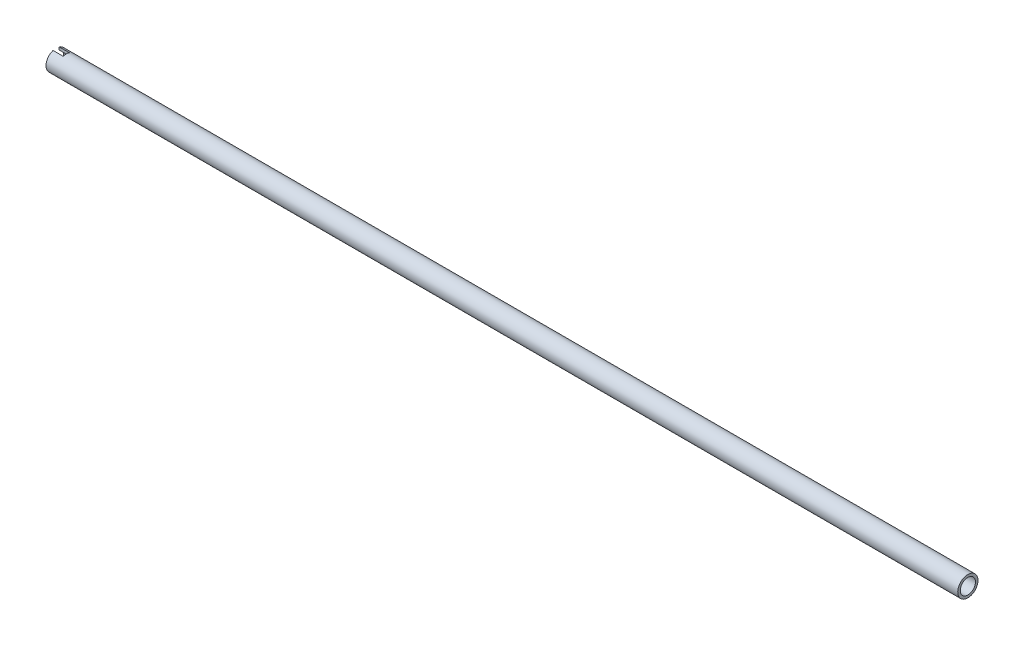
from build123d import *

# Parameters (mm, degrees)
SKETCH1_R           = 1
SKETCH1_R_2         = 0.75
BOSS_EXTRUDE1_DEPTH = 90
CUT_EXTRUDE1_DEPTH  = 1


with BuildPart() as part:
    # Sketch1 → Boss-Extrude1 (new body)
    with BuildSketch(Plane(origin=(0, 0, 0), x_dir=(0, 0, -1), z_dir=(1, 0, 0))):
        Circle(SKETCH1_R)
        Circle(SKETCH1_R_2, mode=Mode.SUBTRACT)
    extrude(amount=BOSS_EXTRUDE1_DEPTH)

    # Sketch2 → Cut-Extrude1 (cut)
    with BuildSketch(Plane.ZY):
        with BuildLine():
            Line((-0.304, 0.610565492), (-0.304, 1.099202537))
            Line((-0.304, 1.099202537), (0.304, 1.099202537))
            Line((0.304, 1.099202537), (0.304, 0.610565492))
            ThreePointArc((0.304, 0.610565492), (0, 0.306565492), (-0.304, 0.610565492))
        make_face()
    extrude(amount=-CUT_EXTRUDE1_DEPTH, mode=Mode.SUBTRACT)


solid = part.part
